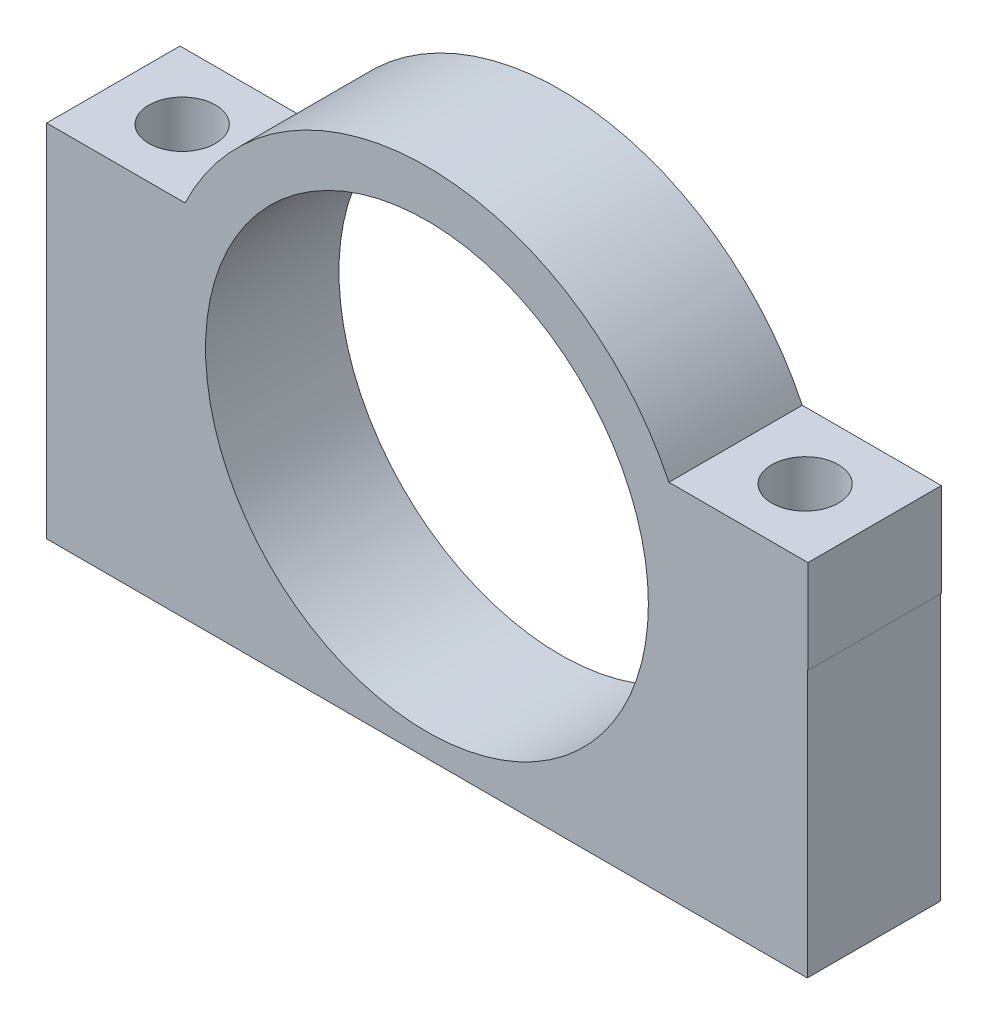
from build123d import *

# Parameters (mm, degrees)
BOSS_EXTRUDE1_DEPTH = 12.7
BOSS_EXTRUDE2_DEPTH = 12.7
SKETCH18_R          = 3.175
CUT_EXTRUDE1_DEPTH  = 34.29


with BuildPart() as part:
    # Sketch1 → Boss-Extrude1 (new body)
    with BuildSketch(Plane.XY):
        with BuildLine():
            Line((36.21435187, 2.127742376), (36.21435187, -23.272257624))
            Line((36.21435187, -23.272257624), (-36.21435187, -23.272257624))
            Line((-36.21435187, -23.272257624), (-36.21435187, 2.127742376))
            Line((-36.21435187, 2.127742376), (-20.97435187, 2.127742376))
            ThreePointArc((-20.97435187, 2.127742376), (0, -21.082), (20.97435187, 2.127742376))
            Line((20.97435187, 2.127742376), (36.21435187, 2.127742376))
        make_face()
    extrude(amount=BOSS_EXTRUDE1_DEPTH)

    # Sketch3 → Boss-Extrude2 (add)
    with BuildSketch(Plane.XY):
        with BuildLine():
            Line((-20.97435187, 2.127742376), (-36.21435187, 2.127742376))
            Line((-36.21435187, 2.127742376), (-36.21435187, 11.017742376))
            Line((-36.21435187, 11.017742376), (-23.036618604, 11.017742376))
            ThreePointArc((-23.036618604, 11.017742376), (0, 25.535787511), (23.036618604, 11.017742376))
            Line((23.036618604, 11.017742376), (36.279630177, 11.017742376))
            Line((36.279630177, 11.017742376), (36.279630177, 2.127742376))
            Line((36.279630177, 2.127742376), (20.97435187, 2.127742376))
            ThreePointArc((20.97435187, 2.127742376), (0, 21.082), (-20.97435187, 2.127742376))
        make_face()
    extrude(amount=BOSS_EXTRUDE2_DEPTH)

    # Sketch18 → Cut-Extrude1 (cut)
    with BuildSketch(Plane(origin=(0, 11.017742376, 0), x_dir=(1, 0, 0), z_dir=(0, 1, 0))):
        with Locations(Location((-29.658124391, -6.35, 0), (0, 0, 180))):
            Circle(SKETCH18_R)
        with Locations(Location((29.658124391, -6.35, 0), (0, 0, 180))):
            Circle(SKETCH18_R)
    extrude(amount=-CUT_EXTRUDE1_DEPTH, mode=Mode.SUBTRACT)


solid = part.part
